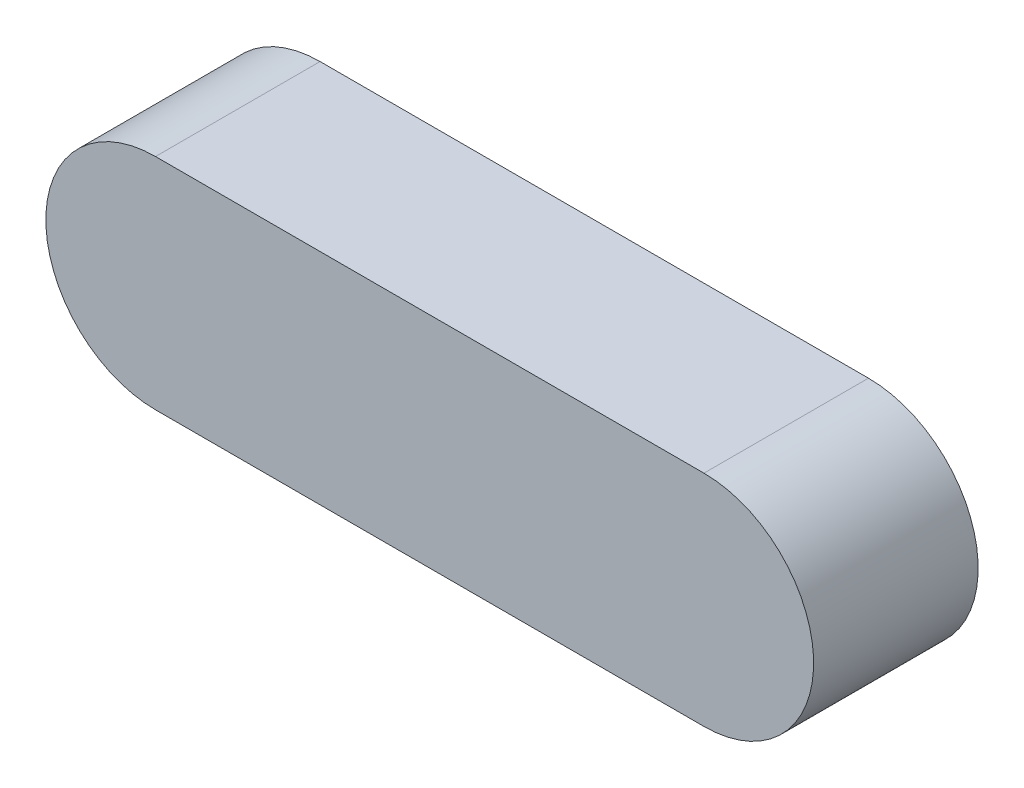
from build123d import *

# Parameters (mm, degrees)
BOSS_EXTRUDE1_DEPTH = 6


with BuildPart() as part:
    # Sketch1 → Boss-Extrude1 (new body)
    with BuildSketch(Plane.XY):
        with BuildLine():
            Line((0, 4), (20, 4))
            ThreePointArc((20, 4), (24, 0), (20, -4))
            Line((20, -4), (0, -4))
            ThreePointArc((0, -4), (-4, 0), (0, 4))
        make_face()
    extrude(amount=BOSS_EXTRUDE1_DEPTH)


solid = part.part
